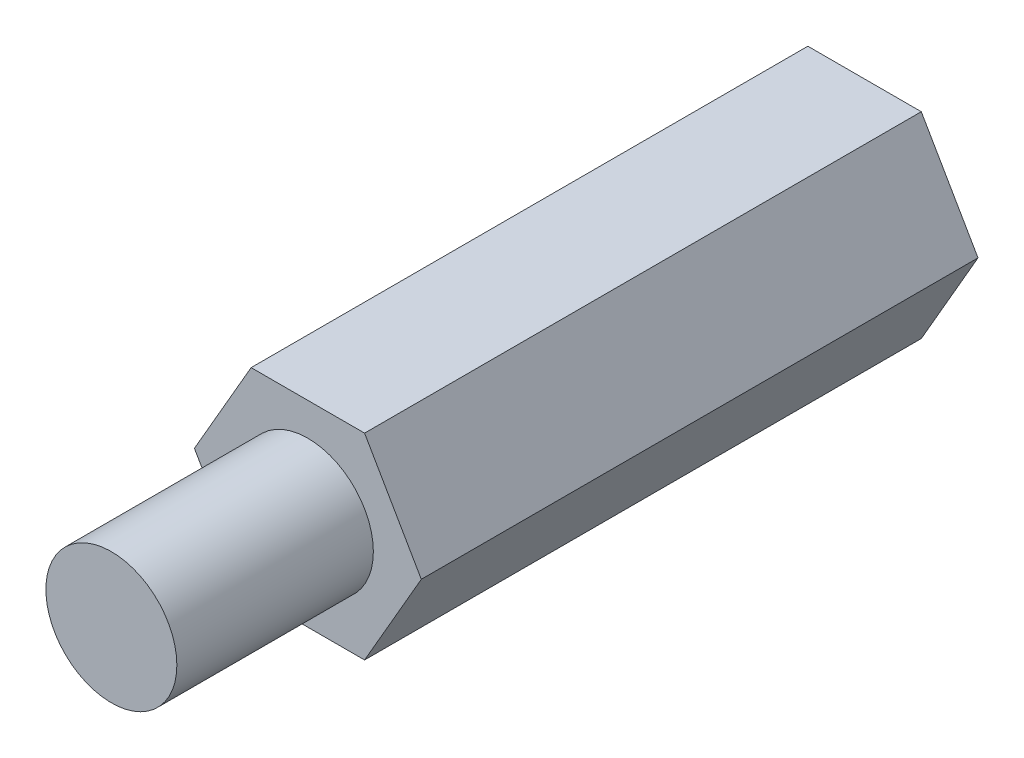
from build123d import *

# Parameters (mm, degrees)
BOSS_EXTRUDE1_DEPTH       = 17
SKETCH2_R                 = 2
BOSS_EXTRUDE2_DEPTH       = 6
F_3_0MM_DOWEL_HOLE1_D     = 3
F_3_0MM_DOWEL_HOLE1_DEPTH = 6
F_3_0MM_DOWEL_HOLE1_TIP   = 0.901290929


with BuildPart() as part:
    # Sketch1 → Boss-Extrude1 (new body)
    with BuildSketch(Plane.XY):
        Polygon((1.732050808, 3), (-1.732050808, 3), (-3.464101615, 0), (-1.732050808, -3), (1.732050808, -3), (3.464101615, 0), align=None)
    extrude(amount=BOSS_EXTRUDE1_DEPTH)

    # Sketch2 → Boss-Extrude2 (add)
    with BuildSketch(Plane.XY.offset(17)):
        Circle(SKETCH2_R)
    extrude(amount=BOSS_EXTRUDE2_DEPTH)

    # Ø3.0mm Dowel Hole1
    with Locations(Plane(origin=(0, 0, 0), x_dir=(-1, 0, 0), z_dir=(0, 0, -1))):
        with Locations((0, 0)):
            Hole(F_3_0MM_DOWEL_HOLE1_D / 2, depth=F_3_0MM_DOWEL_HOLE1_DEPTH)
            with Locations((0, 0, -(F_3_0MM_DOWEL_HOLE1_DEPTH + F_3_0MM_DOWEL_HOLE1_TIP / 2))):  # 118° drill point
                Cone(0, F_3_0MM_DOWEL_HOLE1_D / 2, F_3_0MM_DOWEL_HOLE1_TIP, mode=Mode.SUBTRACT)


solid = part.part
